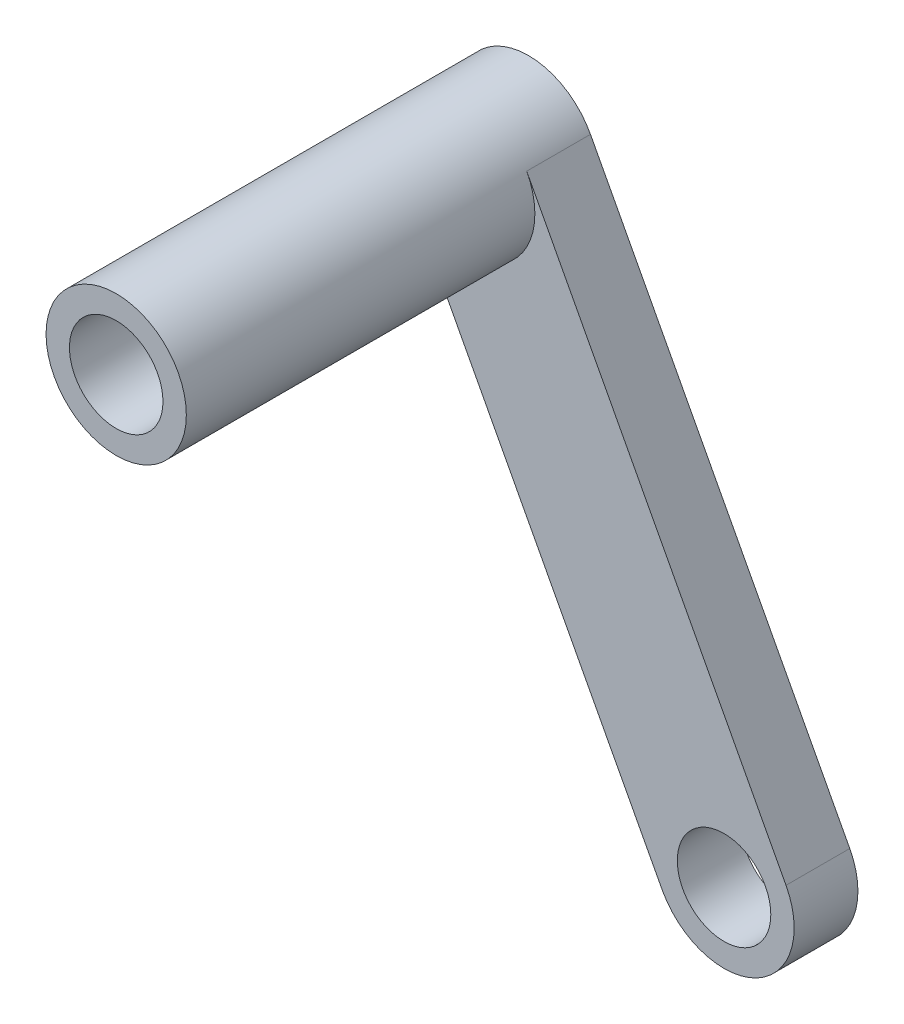
from build123d import *

# Parameters (mm, degrees)
SKETCH1_R           = 2.2
BOSS_EXTRUDE1_DEPTH = 3
SKETCH2_R           = 3.3
SKETCH2_R_2         = 2.2
BOSS_EXTRUDE2_DEPTH = 16.4


with BuildPart() as part:
    # Sketch1 → Boss-Extrude1 (new body)
    with BuildSketch(Plane(origin=(0, 0, 0), x_dir=(-1, 0, 0), z_dir=(0, 0, 1))):
        with BuildLine():
            Line((26.852970862, 7.356194523), (39.052970862, -15.643805477))
            ThreePointArc((39.052970862, -15.643805477), (37.684063375, -20.105429878), (33.222438974, -18.736522391))
            Line((33.222438974, -18.736522391), (21.022438974, 4.263477609))
            ThreePointArc((21.022438974, 4.263477609), (22.391346461, 8.725102009), (26.852970862, 7.356194523))
        make_face()
        with Locations(Location((23.937704918, 5.809836066, 0), (0, 0, 180))):
            Circle(SKETCH1_R, mode=Mode.SUBTRACT)
        with Locations(Location((36.137704918, -17.190163934, 0), (0, 0, 180))):
            Circle(SKETCH1_R, mode=Mode.SUBTRACT)
    extrude(amount=BOSS_EXTRUDE1_DEPTH)

    # Sketch2 → Boss-Extrude2 (add)
    with BuildSketch(Plane.XY.offset(3)):
        with Locations(Location((-36.137704918, 17.190163934, 0), (0, 0, 207.943034423))):
            Circle(SKETCH2_R)
        with Locations((-36.137704918, 17.190163934)):
            Circle(SKETCH2_R_2, mode=Mode.SUBTRACT)
    extrude(amount=BOSS_EXTRUDE2_DEPTH)


solid = part.part
